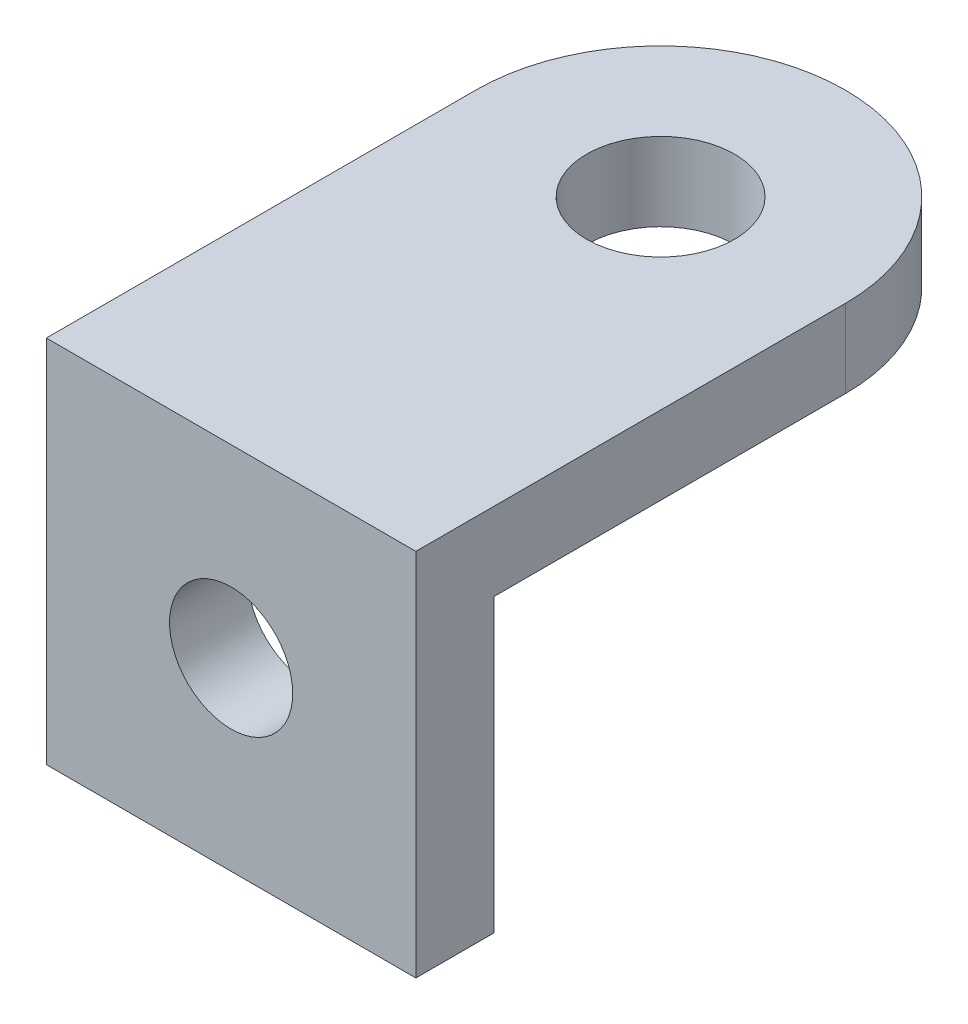
from build123d import *

# Parameters (mm, degrees)
SKETCH1_W           = 15
SKETCH1_H           = 15
SKETCH1_R           = 2.5
BOSS_EXTRUDE1_DEPTH = 3.175
SKETCH2_R           = 3
BOSS_EXTRUDE2_DEPTH = 3.175


with BuildPart() as part:
    # Sketch1 → Boss-Extrude1 (new body)
    with BuildSketch(Plane.XY):
        with Locations((0, -7.5)):
            Rectangle(SKETCH1_W, SKETCH1_H)
        with Locations((0, -7.5)):
            Circle(SKETCH1_R, mode=Mode.SUBTRACT)
    extrude(amount=BOSS_EXTRUDE1_DEPTH)

    # Sketch2 → Boss-Extrude2 (add)
    with BuildSketch(Plane(origin=(0, 0, 0), x_dir=(1, 0, 0), z_dir=(0, 1, 0))):
        with BuildLine():
            Line((-7.5, 14.26), (-7.5, 0))
            Line((-7.5, 0), (7.5, 0))
            Line((7.5, 0), (7.5, 14.26))
            ThreePointArc((7.5, 14.26), (0, 21.76), (-7.5, 14.26))
        make_face()
        with Locations(Location((0, 14.26, 0), (0, 0, 270))):
            Circle(SKETCH2_R, mode=Mode.SUBTRACT)
    extrude(amount=-BOSS_EXTRUDE2_DEPTH)


solid = part.part
